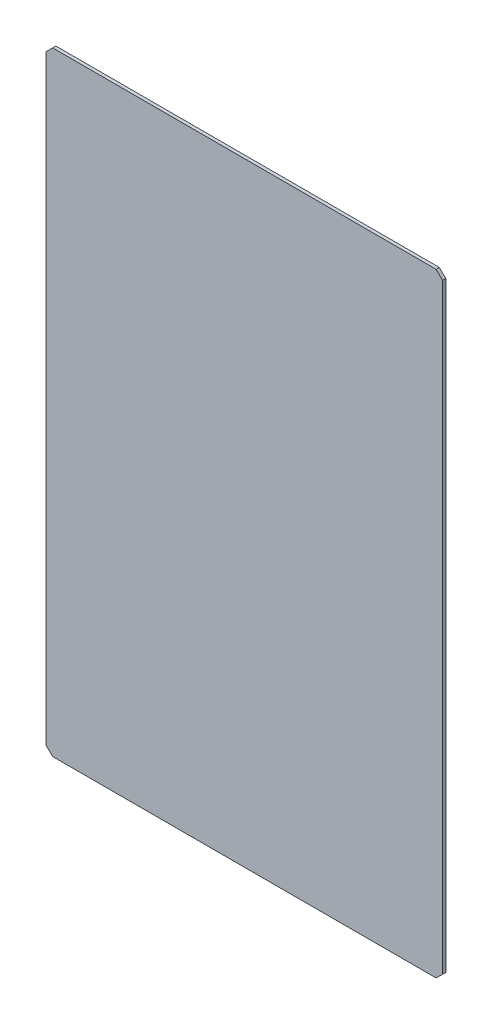
from build123d import *

# Parameters (mm, degrees)
SKETCH1_W           = 196.85
SKETCH1_H           = 304.8
BOSS_EXTRUDE1_DEPTH = 1.5875
CHAMFER1_SIZE       = 3.175


with BuildPart() as part:
    # Sketch1 → Boss-Extrude1 (new body)
    with BuildSketch(Plane.XY):
        Rectangle(SKETCH1_W, SKETCH1_H)
    extrude(amount=BOSS_EXTRUDE1_DEPTH)

    # Chamfer1
    chamfer1_edges = [part.edges().sort_by_distance(p)[0] for p in [
        (-98.425, -152.4, 0.79375),
        (98.425, -152.4, 0.79375),
        (-98.425, 152.4, 0.79375),
        (98.425, 152.4, 0.79375),
    ]]
    chamfer(chamfer1_edges, length=CHAMFER1_SIZE)


solid = part.part
